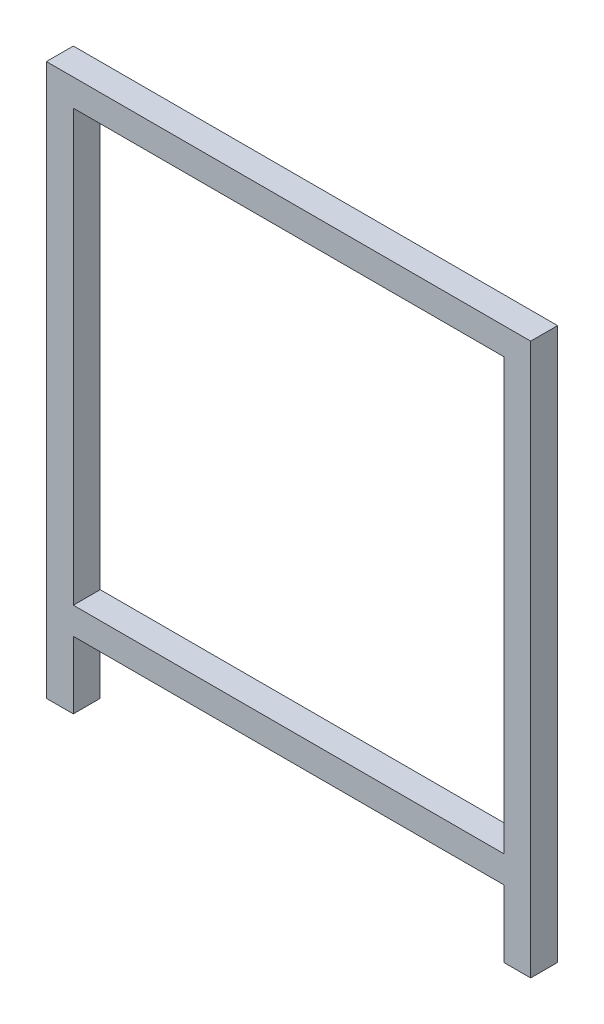
from build123d import *

# Parameters (mm, degrees)
SKETCH2_W           = 320
SKETCH2_H           = 320
BOSS_EXTRUDE1_DEPTH = 10


with BuildPart() as part:
    # Sketch2 → Boss-Extrude1 (new, symmetric)
    with BuildSketch(Plane.XY):
        Polygon((160, -230), (160, -180), (-160, -180), (-160, -230), (-180, -230), (-180, 180), (180, 180), (180, -230), align=None)
        Rectangle(SKETCH2_W, SKETCH2_H, mode=Mode.SUBTRACT)
    extrude(amount=BOSS_EXTRUDE1_DEPTH, both=True)


solid = part.part
